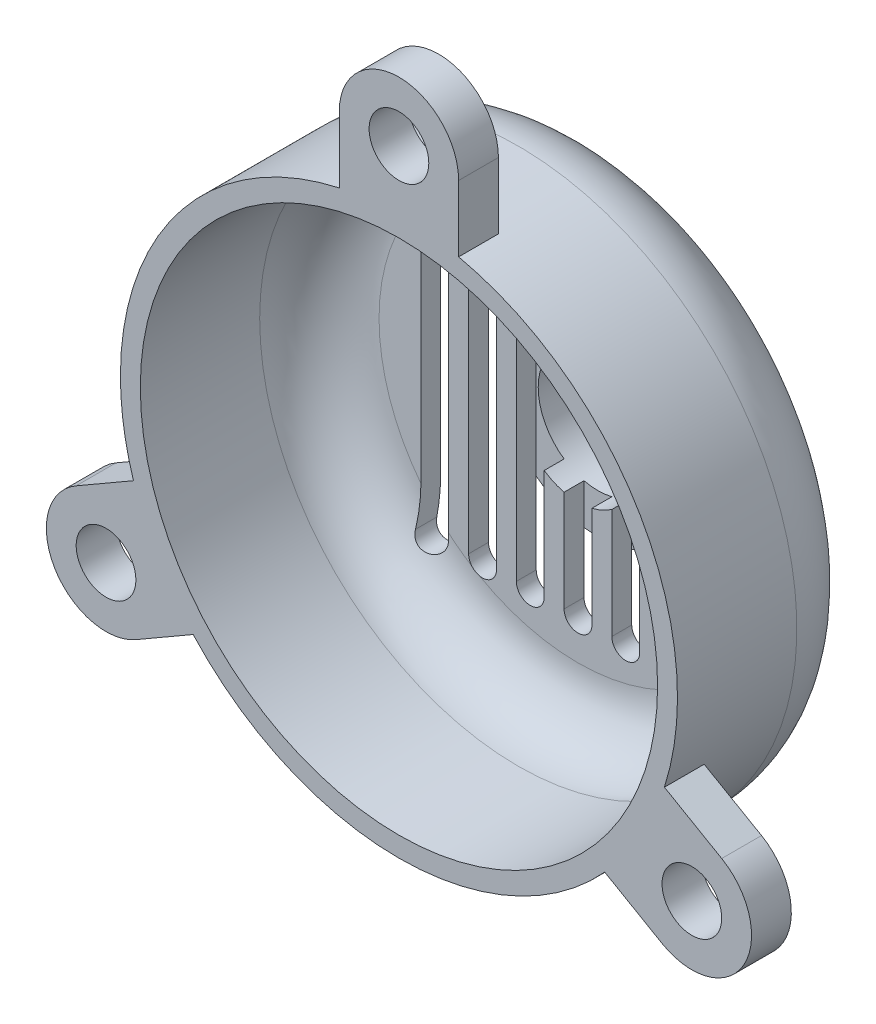
from build123d import *

# Parameters (mm, degrees)
SKETCH2_R           = 1.25
SKETCH2_R_2         = 0.75
BOSS_EXTRUDE1_DEPTH = 0.5
CUT_EXTRUDE1_START  = -0.5
SKETCH3_R           = 0.75
CUT_EXTRUDE1_DEPTH  = 0.5
FILLET4_R           = 0.2
SKETCH4_R           = 0.375
BOSS_EXTRUDE2_DEPTH = 0.5
CUT_EXTRUDE3_DEPTH  = 8.133041914


with BuildPart() as part:
    # Sketch1 → Revolve1 (revolve)
    with BuildSketch(Plane(origin=(0, 0, 0), x_dir=(1, 0, 0), z_dir=(0, 1, 0)), mode=Mode.PRIVATE) as revolve1_sk:
        with BuildLine():
            Line((0, 0), (2.5, 0))
            ThreePointArc((2.5, 0), (3.207106781, -0.292893219), (3.5, -1))
            Line((3.5, -1), (3.5, -2.5))
            Line((3.5, -2.5), (3.25, -2.5))
            Line((3.25, -2.5), (3.25, -1))
            ThreePointArc((3.25, -1), (3.030330086, -0.469669914), (2.5, -0.25))
            Line((2.5, -0.25), (0, -0.25))
            Line((0, -0.25), (0, 0))
        make_face()
    revolve(revolve1_sk.sketch.rotate(Axis((0, 0, -4.115506763), (0, 0, 1)), 180), axis=Axis((0, 0, -4.115506763), (0, 0, 1)))

    # Sketch2 → Boss-Extrude1 (add)
    with BuildSketch(Plane(origin=(0, 0, 0), x_dir=(-1, 0, 0), z_dir=(0, 0, -1))):
        with Locations(Location((0, 0, 0), (0, 0, 180))):
            Circle(SKETCH2_R)
        Circle(SKETCH2_R_2, mode=Mode.SUBTRACT)
    extrude(amount=BOSS_EXTRUDE1_DEPTH)

    # Sketch3 → Cut-Extrude1 (cut)
    with BuildSketch(Plane(origin=(0, 0, 0), x_dir=(-1, 0, 0), z_dir=(0, 0, -1)).offset(CUT_EXTRUDE1_START)):
        Circle(SKETCH3_R)
    extrude(amount=CUT_EXTRUDE1_DEPTH, mode=Mode.SUBTRACT)

    # Fillet4
    fillet4_edges = [part.edges().sort_by_distance(p)[0] for p in [
        (-1.25, 0, -0.5),
    ]]
    fillet(fillet4_edges, radius=FILLET4_R)

    # Sketch4 → Boss-Extrude2 (add)
    # profile 1 of 3: a face of its own
    with BuildSketch(Plane.XY.offset(2.5)):
        with BuildLine():
            Line((0.75, 4.25), (0.75, 3.418698583))
            ThreePointArc((0.75, 3.418698583), (0, 3.5), (-0.75, 3.418698583))
            Line((-0.75, 3.418698583), (-0.75, 4.25))
            ThreePointArc((-0.75, 4.25), (0, 5), (0.75, 4.25))
        make_face()
        with Locations((0, 4.25)):
            Circle(SKETCH4_R, mode=Mode.SUBTRACT)
    # profile 2 of 3: a face of its own
    with BuildSketch(Plane.XY.offset(2.5)):
        with BuildLine():
            Line((3.305607966, -2.774519053), (2.585679821, -2.358868344))
            ThreePointArc((2.585679821, -2.358868344), (3.031088913, -1.75), (3.335679821, -1.059830239))
            Line((3.335679821, -1.059830239), (4.055607966, -1.475480947))
            ThreePointArc((4.055607966, -1.475480947), (4.330127019, -2.5), (3.305607966, -2.774519053))
        make_face()
        with Locations((3.680607966, -2.125)):
            Circle(SKETCH4_R, mode=Mode.SUBTRACT)
    # profile 3 of 3: a face of its own
    with BuildSketch(Plane.XY.offset(2.5)):
        with BuildLine():
            Line((-4.055607966, -1.475480947), (-3.335679821, -1.059830239))
            ThreePointArc((-3.335679821, -1.059830239), (-3.031088913, -1.75), (-2.585679821, -2.358868344))
            Line((-2.585679821, -2.358868344), (-3.305607966, -2.774519053))
            ThreePointArc((-3.305607966, -2.774519053), (-4.330127019, -2.5), (-4.055607966, -1.475480947))
        make_face()
        with Locations((-3.680607966, -2.125)):
            Circle(SKETCH4_R, mode=Mode.SUBTRACT)
    extrude(amount=-BOSS_EXTRUDE2_DEPTH)

    # Sketch5 → Cut-Extrude3 (cut, through all)
    with BuildSketch(Plane(origin=(0, 0, 0), x_dir=(-1, 0, 0), z_dir=(0, 0, -1))):
        with BuildLine():
            Line((-0.175, 2), (-0.175, -2))
            ThreePointArc((-0.175, -2), (0, -2.175), (0.175, -2))
            Line((0.175, -2), (0.175, 2))
            ThreePointArc((0.175, 2), (0, 2.175), (-0.175, 2))
        make_face()
        with BuildLine():
            Line((0.775, 2), (0.775, -2))
            ThreePointArc((0.775, -2), (0.6, -2.175), (0.425, -2))
            Line((0.425, -2), (0.425, 2))
            ThreePointArc((0.425, 2), (0.6, 2.175), (0.775, 2))
        make_face()
        with BuildLine():
            Line((1.375, 2), (1.375, -2))
            ThreePointArc((1.375, -2), (1.2, -2.175), (1.025, -2))
            Line((1.025, -2), (1.025, 2))
            ThreePointArc((1.025, 2), (1.2, 2.175), (1.375, 2))
        make_face()
        with BuildLine():
            Line((1.975, 2), (1.975, -2))
            ThreePointArc((1.975, -2), (1.8, -2.175), (1.625, -2))
            Line((1.625, -2), (1.625, 2))
            ThreePointArc((1.625, 2), (1.8, 2.175), (1.975, 2))
        make_face()
        with BuildLine():
            Line((-0.425, 2), (-0.425, -2))
            ThreePointArc((-0.425, -2), (-0.6, -2.175), (-0.775, -2))
            Line((-0.775, -2), (-0.775, 2))
            ThreePointArc((-0.775, 2), (-0.6, 2.175), (-0.425, 2))
        make_face()
        with BuildLine():
            Line((-1.025, 2), (-1.025, -2))
            ThreePointArc((-1.025, -2), (-1.2, -2.175), (-1.375, -2))
            Line((-1.375, -2), (-1.375, 2))
            ThreePointArc((-1.375, 2), (-1.2, 2.175), (-1.025, 2))
        make_face()
        with BuildLine():
            Line((-1.625, 2), (-1.625, -2))
            ThreePointArc((-1.625, -2), (-1.8, -2.175), (-1.975, -2))
            Line((-1.975, -2), (-1.975, 2))
            ThreePointArc((-1.975, 2), (-1.8, 2.175), (-1.625, 2))
        make_face()
    extrude(amount=-CUT_EXTRUDE3_DEPTH, mode=Mode.SUBTRACT)


solid = part.part
